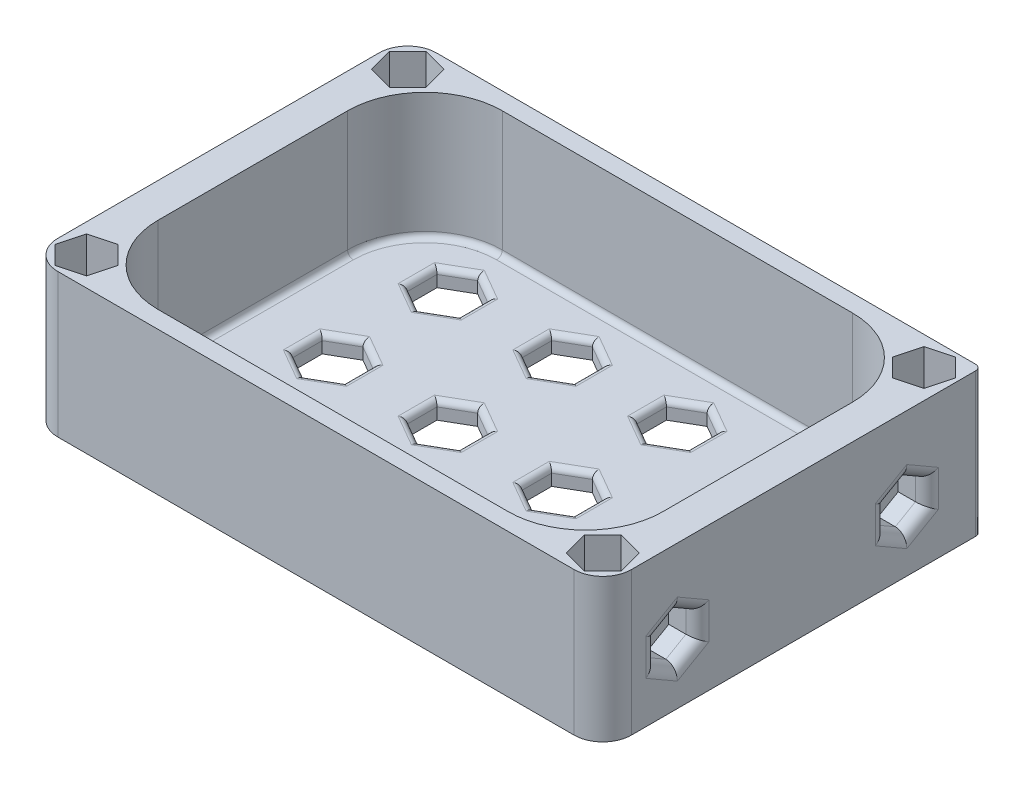
from build123d import *

# Parameters (mm, degrees)
BOSS_EXTRUDE7_DEPTH = 25
BOSS_EXTRUDE9_DEPTH = 3
CUT_EXTRUDE1_DEPTH  = 5
CUT_EXTRUDE2_DEPTH  = 5
FILLET3_R           = 2
FILLET2_R           = 1
FILLET4_R           = 1


with BuildPart() as part:
    # Sketch3 → Boss-Extrude7 (new body)
    with BuildSketch(Plane.XZ):
        with BuildLine():
            Line((-5, -33), (0, -33))
            Line((0, -33), (-1.464466094, -31.535533906))
            ThreePointArc((-1.464466094, -31.535533906), (-3.086582838, -32.619397663), (-5, -33))
        make_face()
        with BuildLine():
            Line((0, -33), (0, -28))
            ThreePointArc((0, -28), (-0.380602337, -29.913417162), (-1.464466094, -31.535533906))
            Line((-1.464466094, -31.535533906), (0, -33))
        make_face()
        with BuildLine():
            ThreePointArc((0, -28), (-1.464466094, -24.464466094), (-5, -23))
            ThreePointArc((-5, -23), (-6.913417162, -23.380602337), (-8.535533906, -24.464466094))
            Line((-8.535533906, -24.464466094), (-7.740038777, -25.259961223))
            Line((-7.740038779, -25.259961224), (-6.158076652, -23.677999097))
            Line((-6.158076652, -23.677999097), (-3.997076244, -24.257037411))
            Line((-3.997076244, -24.257037411), (-1.836075749, -24.836075749))
            Line((-1.836075749, -24.836075749), (-1.257037428, -26.99707618))
            Line((-1.257037428, -26.99707618), (-0.677999097, -29.158076652))
            Line((-0.677999097, -29.158076652), (-2.259961219, -30.740038773))
            Line((-2.259961223, -30.740038777), (-1.464466094, -31.535533906))
            ThreePointArc((-1.464466094, -31.535533906), (-0.380602337, -29.913417162), (0, -28))
        make_face()
        with BuildLine():
            Line((-7.740038777, -25.259961223), (-8.535533906, -24.464466094))
            ThreePointArc((-8.535533906, -24.464466094), (-8.732910174, -24.67353316), (-8.917942987, -24.893599712))
            ThreePointArc((-8.917942987, -24.893599712), (-9.721743054, -26.355268249), (-10, -28))
            ThreePointArc((-10, -28), (-8.535533906, -31.535533906), (-5, -33))
            ThreePointArc((-5, -33), (-3.086582838, -32.619397663), (-1.464466094, -31.535533906))
            Line((-1.464466094, -31.535533906), (-2.259961223, -30.740038777))
            Line((-2.259961219, -30.740038773), (-3.841923348, -32.322000903))
            Line((-3.841923348, -32.322000903), (-6.002923801, -31.742962577))
            Line((-6.002923801, -31.742962577), (-8.163924251, -31.163924251))
            Line((-8.163924251, -31.163924251), (-8.742962601, -29.002923708))
            Line((-8.742962601, -29.002923708), (-9.322000903, -26.841923348))
            Line((-9.322000903, -26.841923348), (-7.740038779, -25.259961224))
        make_face()
        with BuildLine():
            Line((0, -28), (0, -23))
            Line((0, -23), (-5, -23))
            ThreePointArc((-5, -23), (-1.464466094, -24.464466094), (0, -28))
        make_face()
        with BuildLine():
            Line((-5, -23), (-6, -23))
            Line((-6, -23), (-7.661030441, -23))
            ThreePointArc((-7.661030441, -23), (-8.091942003, -23.730311477), (-8.567907791, -24.432092209))
            Line((-8.567907791, -24.432092209), (-8.535533906, -24.464466094))
            ThreePointArc((-8.535533906, -24.464466094), (-6.913417162, -23.380602337), (-5, -23))
        make_face()
        with BuildLine():
            ThreePointArc((-8.917942987, -24.893599712), (-9.440797856, -25.51377538), (-10, -26.101387527))
            Line((-10, -26.101387527), (-10, -28))
            ThreePointArc((-10, -28), (-9.721743054, -26.355268249), (-8.917942987, -24.893599712))
        make_face()
        with BuildLine():
            Line((-8.535533906, -24.464466094), (-8.567907791, -24.432092209))
            ThreePointArc((-8.567907791, -24.432092209), (-8.740446841, -24.664725841), (-8.917942987, -24.893599712))
            ThreePointArc((-8.917942987, -24.893599712), (-8.732910174, -24.67353316), (-8.535533906, -24.464466094))
        make_face()
        with BuildLine():
            ThreePointArc((-5, -33), (-8.535533906, -31.535533906), (-10, -28))
            Line((-10, -28), (-10, -30))
            Line((-10, -30), (-10, -33))
            Line((-10, -33), (-5, -33))
        make_face()
        with BuildLine():
            Line((-10, -28), (-10, -26.101387527))
            ThreePointArc((-10, -26.101387527), (-14.356609245, -28.987317436), (-19.483314774, -30))
            Line((-19.483314774, -30), (-10, -30))
            Line((-10, -30), (-10, -28))
        make_face()
        Polygon((-10, -30), (-19.483314774, -30), (-80.516685226, -30), (-90, -30), (-90, -33), (-10, -33), align=None)
        Polygon((0, 0), (-6, 0), (-6, -16.516685226), (-6, -23), (-5, -23), (0, -23), align=None)
        with BuildLine():
            Line((-6, -23), (-6, -16.516685226))
            ThreePointArc((-6, -16.516685226), (-6.421857001, -19.863041177), (-7.661030441, -23))
            Line((-7.661030441, -23), (-6, -23))
        make_face()
        Polygon((-6, 16.516685226), (-6, 0), (0, 0), (0, 23), (-5, 23), (-6, 23), align=None)
        with BuildLine():
            ThreePointArc((-7.661030441, 23), (-6.421857001, 19.863041177), (-6, 16.516685226))
            Line((-6, 16.516685226), (-6, 23))
            Line((-6, 23), (-7.661030441, 23))
        make_face()
        with BuildLine():
            Line((-7.661030441, 23), (-6, 23))
            Line((-6, 23), (-5, 23))
            ThreePointArc((-5, 23), (-6.913417162, 23.380602337), (-8.535533906, 24.464466094))
            Line((-8.535533906, 24.464466094), (-8.567907791, 24.432092209))
            ThreePointArc((-8.567907791, 24.432092209), (-8.091942003, 23.730311477), (-7.661030441, 23))
        make_face()
        with BuildLine():
            Line((-10, 28), (-10, 26.101387527))
            ThreePointArc((-10, 26.101387527), (-9.440797857, 25.513775382), (-8.91794299, 24.893599716))
            ThreePointArc((-8.91794299, 24.893599716), (-9.721743055, 26.355268251), (-10, 28))
        make_face()
        with BuildLine():
            ThreePointArc((-19.483314774, 30), (-14.356609245, 28.987317436), (-10, 26.101387527))
            Line((-10, 26.101387527), (-10, 28))
            Line((-10, 28), (-10, 30))
            Line((-10, 30), (-19.483314774, 30))
        make_face()
        with BuildLine():
            ThreePointArc((-8.91794299, 24.893599716), (-8.740446842, 24.664725843), (-8.567907791, 24.432092209))
            Line((-8.567907791, 24.432092209), (-8.535533906, 24.464466094))
            ThreePointArc((-8.535533906, 24.464466094), (-8.732910175, 24.673533162), (-8.91794299, 24.893599716))
        make_face()
        with BuildLine():
            ThreePointArc((-8.91794299, 24.893599716), (-8.732910175, 24.673533162), (-8.535533906, 24.464466094))
            Line((-8.535533906, 24.464466094), (-7.740038777, 25.259961223))
            Line((-7.740038777, 25.259961223), (-9.322000903, 26.841923348))
            Line((-9.322000903, 26.841923348), (-8.742962597, 29.002923724))
            Line((-8.742962597, 29.002923724), (-8.163924251, 31.163924251))
            Line((-8.163924251, 31.163924251), (-6.002923796, 31.742962578))
            Line((-6.002923796, 31.742962578), (-3.841923348, 32.322000903))
            Line((-3.841923348, 32.322000903), (-2.259961222, 30.740038776))
            Line((-2.259961223, 30.740038777), (-1.464466094, 31.535533906))
            ThreePointArc((-1.464466094, 31.535533906), (-3.086582838, 32.619397663), (-5, 33))
            ThreePointArc((-5, 33), (-8.535533906, 31.535533906), (-10, 28))
            ThreePointArc((-10, 28), (-9.721743055, 26.355268251), (-8.91794299, 24.893599716))
        make_face()
        with BuildLine():
            ThreePointArc((-8.535533906, 24.464466094), (-6.913417162, 23.380602337), (-5, 23))
            ThreePointArc((-5, 23), (-1.464466094, 24.464466094), (0, 28))
            ThreePointArc((0, 28), (-0.380602337, 29.913417162), (-1.464466094, 31.535533906))
            Line((-1.464466094, 31.535533906), (-2.259961223, 30.740038777))
            Line((-2.259961222, 30.740038776), (-0.677999097, 29.158076652))
            Line((-0.677999097, 29.158076652), (-1.257037425, 26.997076192))
            Line((-1.257037425, 26.997076192), (-1.836075749, 24.836075749))
            Line((-1.836075749, 24.836075749), (-3.997076664, 24.257037299))
            Line((-3.997076664, 24.257037299), (-6.158076652, 23.677999097))
            Line((-6.158076652, 23.677999097), (-7.740038777, 25.259961223))
            Line((-7.740038777, 25.259961223), (-8.535533906, 24.464466094))
        make_face()
        with BuildLine():
            Line((-5, 23), (0, 23))
            Line((0, 23), (0, 28))
            ThreePointArc((0, 28), (-1.464466094, 24.464466094), (-5, 23))
        make_face()
        Polygon((-80.516685226, 30), (-19.483314774, 30), (-10, 30), (-10, 33), (-90, 33), (-90, 30), align=None)
        with BuildLine():
            Line((-10, 30), (-10, 28))
            ThreePointArc((-10, 28), (-8.535533906, 31.535533906), (-5, 33))
            Line((-5, 33), (-10, 33))
            Line((-10, 33), (-10, 30))
        make_face()
        with BuildLine():
            Line((-90, -30), (-80.516685226, -30))
            ThreePointArc((-80.516685226, -30), (-85.643390755, -28.987317436), (-90, -26.101387527))
            Line((-90, -26.101387527), (-90, -28))
            Line((-90, -28), (-90, -30))
        make_face()
        with BuildLine():
            Line((-90, -33), (-90, -30))
            Line((-90, -30), (-90, -28))
            ThreePointArc((-90, -28), (-91.464466094, -31.535533906), (-95, -33))
            Line((-95, -33), (-90, -33))
        make_face()
        with BuildLine():
            ThreePointArc((-95, -33), (-91.464466094, -31.535533906), (-90, -28))
            ThreePointArc((-90, -28), (-90.278256873, -26.355268458), (-91.082056738, -24.893600059))
            ThreePointArc((-91.082056738, -24.893600059), (-91.267089679, -24.673533326), (-91.464466094, -24.464466094))
            Line((-91.464466094, -24.464466094), (-92.259961223, -25.259961223))
            Line((-92.259961223, -25.259961223), (-90.677999097, -26.841923348))
            Line((-90.677999097, -26.841923348), (-91.257037439, -29.00292386))
            Line((-91.257037439, -29.00292386), (-91.836075749, -31.163924251))
            Line((-91.836075749, -31.163924251), (-93.997076192, -31.742962575))
            Line((-93.997076192, -31.742962575), (-96.158076652, -32.322000903))
            Line((-96.158076652, -32.322000903), (-97.740038777, -30.740038777))
            Line((-97.740038777, -30.740038777), (-98.535533906, -31.535533906))
            ThreePointArc((-98.535533906, -31.535533906), (-96.913417162, -32.619397663), (-95, -33))
        make_face()
        with BuildLine():
            Line((-92.259961223, -25.259961223), (-91.464466094, -24.464466094))
            ThreePointArc((-91.464466094, -24.464466094), (-93.086582815, -23.380602347), (-94.999999951, -23))
            ThreePointArc((-94.999999951, -23), (-98.535533888, -24.464466077), (-100, -28))
            ThreePointArc((-100, -28), (-99.619397663, -29.913417162), (-98.535533906, -31.535533906))
            Line((-98.535533906, -31.535533906), (-97.740038777, -30.740038777))
            Line((-97.740038777, -30.740038777), (-99.322000903, -29.158076652))
            Line((-99.322000903, -29.158076652), (-98.742962693, -26.997076632))
            Line((-98.742962693, -26.997076632), (-98.163924251, -24.836075749))
            Line((-98.163924251, -24.836075749), (-96.002923368, -24.257037307))
            Line((-96.002923368, -24.257037307), (-93.841923348, -23.677999097))
            Line((-93.841923348, -23.677999097), (-92.259961223, -25.259961223))
        make_face()
        with BuildLine():
            ThreePointArc((-100, -28), (-98.535533888, -24.464466077), (-94.999999951, -23))
            Line((-94.999999951, -23), (-100, -23))
            Line((-100, -23), (-100, -28))
        make_face()
        with BuildLine():
            ThreePointArc((-91.464466094, -24.464466094), (-91.267089679, -24.673533326), (-91.082056738, -24.893600059))
            ThreePointArc((-91.082056738, -24.893600059), (-91.259553025, -24.664726018), (-91.432092209, -24.432092209))
            Line((-91.432092209, -24.432092209), (-91.464466094, -24.464466094))
        make_face()
        with BuildLine():
            ThreePointArc((-91.432092209, -24.432092209), (-91.908057997, -23.730311477), (-92.338969559, -23))
            Line((-92.338969559, -23), (-94, -23))
            Line((-94, -23), (-94.999999951, -23))
            ThreePointArc((-94.999999951, -23), (-93.086582815, -23.380602347), (-91.464466094, -24.464466094))
            Line((-91.464466094, -24.464466094), (-91.432092209, -24.432092209))
        make_face()
        with BuildLine():
            Line((-90, -28), (-90, -26.101387527))
            ThreePointArc((-90, -26.101387527), (-90.559201997, -25.513775545), (-91.082056738, -24.893600059))
            ThreePointArc((-91.082056738, -24.893600059), (-90.278256873, -26.355268458), (-90, -28))
        make_face()
        Polygon((-94, 16.516685226), (-94, 23), (-95, 23), (-100, 23), (-100, -23), (-94.999999951, -23), (-94, -23), (-94, -16.516685226), align=None)
        with BuildLine():
            Line((-94, -23), (-92.338969559, -23))
            ThreePointArc((-92.338969559, -23), (-93.578142999, -19.863041177), (-94, -16.516685226))
            Line((-94, -16.516685226), (-94, -23))
        make_face()
        with BuildLine():
            ThreePointArc((-94, 16.516685226), (-93.578142999, 19.863041177), (-92.338969559, 23))
            Line((-92.338969559, 23), (-94, 23))
            Line((-94, 23), (-94, 16.516685226))
        make_face()
        with BuildLine():
            Line((-94, 23), (-92.338969559, 23))
            ThreePointArc((-92.338969559, 23), (-91.908057997, 23.730311477), (-91.432092209, 24.432092209))
            Line((-91.432092209, 24.432092209), (-91.464466094, 24.464466094))
            ThreePointArc((-91.464466094, 24.464466094), (-93.086582838, 23.380602337), (-95, 23))
            Line((-95, 23), (-94, 23))
        make_face()
        with BuildLine():
            ThreePointArc((-91.432092209, 24.432092209), (-91.259553334, 24.66472561), (-91.082057373, 24.893599258))
            ThreePointArc((-91.082057373, 24.893599258), (-91.267090019, 24.673532944), (-91.464466094, 24.464466094))
            Line((-91.464466094, 24.464466094), (-91.432092209, 24.432092209))
        make_face()
        with BuildLine():
            ThreePointArc((-91.082057373, 24.893599258), (-90.559202338, 25.513775164), (-90, 26.101387527))
            Line((-90, 26.101387527), (-90, 28))
            ThreePointArc((-90, 28), (-90.278257041, 26.355267975), (-91.082057373, 24.893599258))
        make_face()
        with BuildLine():
            ThreePointArc((-91.082057373, 24.893599258), (-90.278257041, 26.355267975), (-90, 28))
            ThreePointArc((-90, 28), (-91.464466094, 31.535533906), (-95, 33))
            ThreePointArc((-95, 33), (-96.913417162, 32.619397663), (-98.535533906, 31.535533906))
            Line((-98.535533906, 31.535533906), (-97.740038777, 30.740038777))
            Line((-97.740038777, 30.740038777), (-96.158076652, 32.322000903))
            Line((-96.158076652, 32.322000903), (-93.997076276, 31.742962597))
            Line((-93.997076276, 31.742962597), (-91.836075749, 31.163924251))
            Line((-91.836075749, 31.163924251), (-91.257037406, 29.002923736))
            Line((-91.257037406, 29.002923736), (-90.677999097, 26.841923348))
            Line((-90.677999097, 26.841923348), (-92.259961223, 25.259961223))
            Line((-92.259961223, 25.259961223), (-91.464466094, 24.464466094))
            ThreePointArc((-91.464466094, 24.464466094), (-91.267090019, 24.673532944), (-91.082057373, 24.893599258))
        make_face()
        with BuildLine():
            ThreePointArc((-95, 23), (-93.086582838, 23.380602337), (-91.464466094, 24.464466094))
            Line((-91.464466094, 24.464466094), (-92.259961223, 25.259961223))
            Line((-92.259961223, 25.259961223), (-93.841923348, 23.677999097))
            Line((-93.841923348, 23.677999097), (-96.00292408, 24.257037498))
            Line((-96.00292408, 24.257037498), (-98.163924251, 24.836075749))
            Line((-98.163924251, 24.836075749), (-98.742962597, 26.997076276))
            Line((-98.742962597, 26.997076276), (-99.322000903, 29.158076652))
            Line((-99.322000903, 29.158076652), (-97.740038777, 30.740038777))
            Line((-97.740038777, 30.740038777), (-98.535533906, 31.535533906))
            ThreePointArc((-98.535533906, 31.535533906), (-99.619397687, 29.913417102), (-100, 27.999999871))
            ThreePointArc((-100, 27.999999871), (-98.53553386, 24.464466048), (-95, 23))
        make_face()
        with BuildLine():
            Line((-100, 23), (-95, 23))
            ThreePointArc((-95, 23), (-98.53553386, 24.464466048), (-100, 27.999999871))
            Line((-100, 27.999999871), (-100, 23))
        make_face()
        with BuildLine():
            Line((-90, 28), (-90, 30))
            Line((-90, 30), (-90, 33))
            Line((-90, 33), (-95, 33))
            ThreePointArc((-95, 33), (-91.464466094, 31.535533906), (-90, 28))
        make_face()
        with BuildLine():
            ThreePointArc((-90, 26.101387527), (-85.643390755, 28.987317436), (-80.516685226, 30))
            Line((-80.516685226, 30), (-90, 30))
            Line((-90, 30), (-90, 28))
            Line((-90, 28), (-90, 26.101387527))
        make_face()
    extrude(amount=-BOSS_EXTRUDE7_DEPTH)

    # Sketch3<7> → Boss-Extrude9 (add)
    with BuildSketch(Plane.XZ):
        with BuildLine():
            Line((-6, -16.516685226), (-6, 0))
            Line((-6, 0), (-6, 16.516685226))
            ThreePointArc((-6, 16.516685226), (-9.949171464, 26.050828536), (-19.483314774, 30))
            Line((-19.483314774, 30), (-80.516685226, 30))
            ThreePointArc((-80.516685226, 30), (-90.050828536, 26.050828536), (-94, 16.516685226))
            Line((-94, 16.516685226), (-94, -16.516685226))
            ThreePointArc((-94, -16.516685226), (-90.050828536, -26.050828536), (-80.516685226, -30))
            Line((-80.516685226, -30), (-19.483314774, -30))
            ThreePointArc((-19.483314774, -30), (-9.949171464, -26.050828536), (-6, -16.516685226))
        make_face()
        Polygon((-84.5, -17.401923789), (-80, -14.803847577), (-75.5, -17.401923789), (-75.5, -22.598076211), (-80, -25.196152423), (-84.5, -22.598076211), align=None, mode=Mode.SUBTRACT)
        Polygon((-64.5, -17.401923789), (-60, -14.803847577), (-55.5, -17.401923789), (-55.5, -22.598076211), (-60, -25.196152423), (-64.5, -22.598076211), align=None, mode=Mode.SUBTRACT)
        Polygon((-75.5, 2.598076211), (-75.5, -2.598076211), (-80, -5.196152423), (-84.5, -2.598076211), (-84.5, 2.598076211), (-80, 5.196152423), align=None, mode=Mode.SUBTRACT)
        Polygon((-44.5, -17.401923789), (-40, -14.803847577), (-35.5, -17.401923789), (-35.5, -22.598076211), (-40, -25.196152423), (-44.5, -22.598076211), align=None, mode=Mode.SUBTRACT)
        Polygon((-24.5, -22.598076211), (-24.5, -17.401923789), (-20, -14.803847577), (-15.5, -17.401923789), (-15.5, -22.598076211), (-20, -25.196152423), align=None, mode=Mode.SUBTRACT)
        Polygon((-55.5, 2.598076211), (-55.5, -2.598076211), (-60, -5.196152423), (-64.5, -2.598076211), (-64.5, 2.598076211), (-60, 5.196152423), align=None, mode=Mode.SUBTRACT)
        Polygon((-75.5, 17.401923789), (-80, 14.803847577), (-84.5, 17.401923789), (-84.5, 22.598076211), (-80, 25.196152423), (-75.5, 22.598076211), align=None, mode=Mode.SUBTRACT)
        Polygon((-60, 14.803847577), (-64.5, 17.401923789), (-64.5, 22.598076211), (-60, 25.196152423), (-55.5, 22.598076211), (-55.5, 17.401923789), align=None, mode=Mode.SUBTRACT)
        Polygon((-35.5, 2.598076211), (-35.5, -2.598076211), (-40, -5.196152423), (-44.5, -2.598076211), (-44.5, 2.598076211), (-40, 5.196152423), align=None, mode=Mode.SUBTRACT)
        Polygon((-15.5, 2.598076211), (-15.5, 0), (-15.5, -2.598076211), (-20, -5.196152423), (-24.5, -2.598076211), (-24.5, 2.598076211), (-20, 5.196152423), align=None, mode=Mode.SUBTRACT)
        Polygon((-35.5, 22.598076211), (-35.5, 17.401923789), (-40, 14.803847577), (-44.5, 17.401923789), (-44.5, 22.598076211), (-40, 25.196152423), align=None, mode=Mode.SUBTRACT)
        Polygon((-15.5, 17.401923789), (-20, 14.803847577), (-24.5, 17.401923789), (-24.5, 22.598076211), (-20, 25.196152423), (-15.5, 22.598076211), align=None, mode=Mode.SUBTRACT)
    extrude(amount=-BOSS_EXTRUDE9_DEPTH)

    # Sketch5 → Cut-Extrude1 (cut)
    with BuildSketch(Plane.ZY.offset(100)):
        Polygon((-20, 6.458548116), (-16.5, 8.479274058), (-16.5, 12.520725942), (-20, 14.541451884), (-23.5, 12.520725942), (-23.5, 8.479274058), align=None)
        Polygon((23.5, 8.479274058), (23.5, 12.520725942), (20, 14.541451884), (16.5, 12.520725942), (16.5, 8.479274058), (20, 6.458548116), align=None)
    extrude(amount=-CUT_EXTRUDE1_DEPTH, mode=Mode.SUBTRACT)

    # Sketch6 → Cut-Extrude2 (cut)
    with BuildSketch(Plane(origin=(0, 0, 0), x_dir=(0, 0, -1), z_dir=(1, 0, 0))):
        Polygon((-20, 6.458548116), (-16.5, 8.479274058), (-16.5, 12.520725942), (-20, 14.541451884), (-23.5, 12.520725942), (-23.5, 8.479274058), align=None)
        Polygon((20, 6.458548116), (23.5, 8.479274058), (23.5, 12.520725942), (20, 14.541451884), (16.5, 12.520725942), (16.5, 8.479274058), align=None)
    extrude(amount=-CUT_EXTRUDE2_DEPTH, mode=Mode.SUBTRACT)

    # Fillet3
    fillet3_edges = [part.edges().sort_by_distance(p)[0] for p in [
        (0, 13.531088913, 18.25),
        (0, 13.531088913, 21.75),
        (0, 10.5, 23.5),
        (0, 7.468911087, 21.75),
        (0, 7.468911087, 18.25),
        (0, 10.5, 16.5),
        (0, 13.531088913, -21.75),
        (0, 13.531088913, -18.25),
        (0, 10.5, -16.5),
        (0, 7.468911087, -18.25),
        (0, 7.468911087, -21.75),
        (0, 10.5, -23.5),
    ]]
    fillet(fillet3_edges, radius=FILLET3_R)

    # Fillet2
    fillet2_edges = [part.edges().sort_by_distance(p)[0] for p in [
        (0, 12.5, -33),
    ]]
    fillet(fillet2_edges, radius=FILLET2_R)

    # Fillet4
    fillet4_edges = [part.edges().sort_by_distance(p)[0] for p in [
        (-50, 3, -30),
        (-90.050828536, 3, -26.050828536),
        (-94, 3, 0),
        (-37.75, 3, 3.897114317),
        (-42.25, 3, 3.897114317),
        (-44.5, 3, 0),
        (-42.25, 3, -3.897114317),
        (-37.75, 3, -3.897114317),
        (-35.5, 3, 0),
        (-62.25, 3, 16.102885683),
        (-57.75, 3, 16.102885683),
        (-55.5, 3, 20),
        (-57.75, 3, 23.897114317),
        (-62.25, 3, 23.897114317),
        (-64.5, 3, 20),
        (-75.5, 3, 0),
        (-77.75, 3, 3.897114317),
        (-82.25, 3, 3.897114317),
        (-84.5, 3, 0),
        (-82.25, 3, -3.897114317),
        (-77.75, 3, -3.897114317),
        (-62.25, 3, -3.897114317),
        (-57.75, 3, -3.897114317),
        (-55.5, 3, 0),
        (-57.75, 3, 3.897114317),
        (-62.25, 3, 3.897114317),
        (-64.5, 3, 0),
        (-42.25, 3, 16.102885683),
        (-37.75, 3, 16.102885683),
        (-35.5, 3, 20),
        (-37.75, 3, 23.897114317),
        (-42.25, 3, 23.897114317),
        (-44.5, 3, 20),
        (-37.75, 3, -16.102885683),
        (-42.25, 3, -16.102885683),
        (-44.5, 3, -20),
        (-42.25, 3, -23.897114317),
        (-37.75, 3, -23.897114317),
        (-35.5, 3, -20),
        (-22.25, 3, 3.897114317),
        (-24.5, 3, 0),
        (-22.25, 3, -3.897114317),
        (-17.75, 3, -3.897114317),
        (-15.5, 3, 0),
        (-17.75, 3, 3.897114317),
        (-90.050828536, 3, 26.050828536),
        (-50, 3, 30),
        (-9.949171464, 3, 26.050828536),
        (-6, 3, 0),
        (-9.949171464, 3, -26.050828536),
        (-22.25, 3, 16.102885683),
        (-17.75, 3, 16.102885683),
        (-15.5, 3, 20),
        (-17.75, 3, 23.897114317),
        (-22.25, 3, 23.897114317),
        (-24.5, 3, 20),
        (-77.75, 3, 16.102885683),
        (-75.5, 3, 20),
        (-77.75, 3, 23.897114317),
        (-82.25, 3, 23.897114317),
        (-84.5, 3, 20),
        (-82.25, 3, 16.102885683),
        (-77.75, 3, -16.102885683),
        (-82.25, 3, -16.102885683),
        (-84.5, 3, -20),
        (-82.25, 3, -23.897114317),
        (-77.75, 3, -23.897114317),
        (-75.5, 3, -20),
        (-22.25, 3, -16.102885683),
        (-24.5, 3, -20),
        (-22.25, 3, -23.897114317),
        (-17.75, 3, -23.897114317),
        (-15.5, 3, -20),
        (-17.75, 3, -16.102885683),
        (-57.75, 3, -16.102885683),
        (-62.25, 3, -16.102885683),
        (-64.5, 3, -20),
        (-62.25, 3, -23.897114317),
        (-57.75, 3, -23.897114317),
        (-55.5, 3, -20),
    ]]
    fillet(fillet4_edges, radius=FILLET4_R)


solid = part.part
